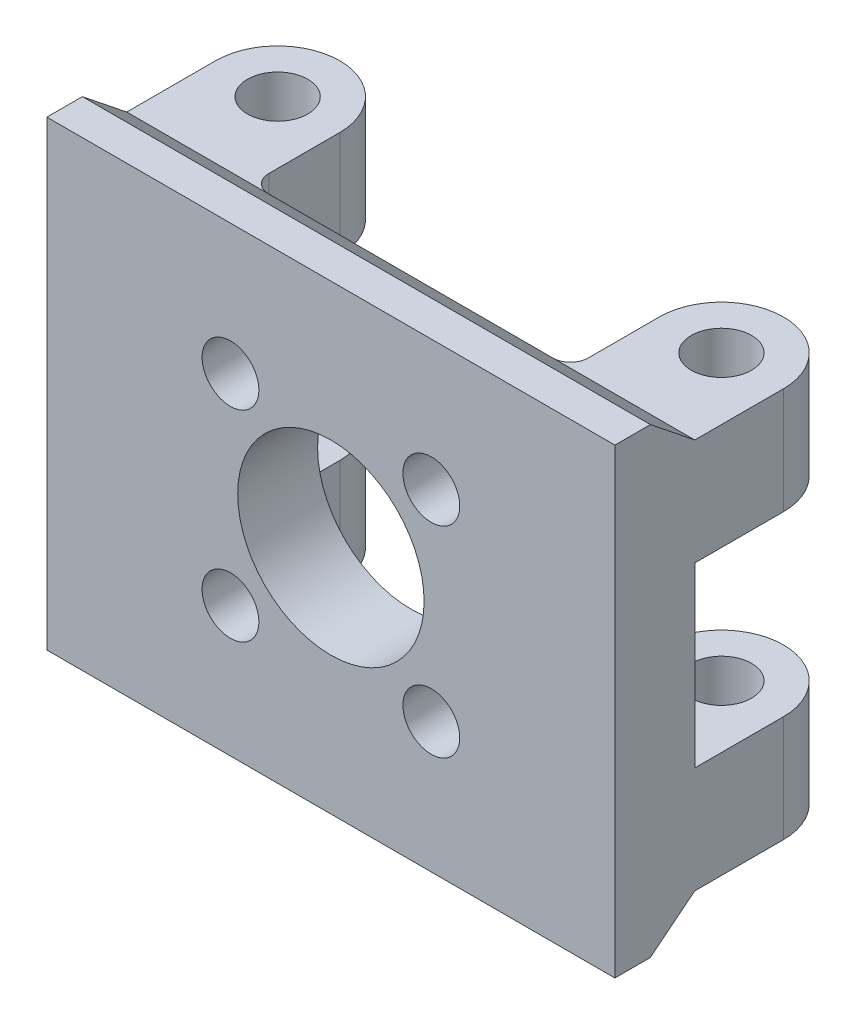
from build123d import *

# Parameters (mm, degrees)
SKETCH_1_W                  = 32
SKETCH_1_H                  = 22
EXTRUDE_1_DEPTH             = 2.5
EXTRUDE_2_DEPTH             = 6
EXTRUDE_3_DEPTH             = 6
EXTRUDE_START               = -6
EXTRUDE_4_DEPTH             = 6
EXTRUDE_5_DEPTH             = 6
HOLE_WIZARD_3_4_3_4_1_D     = 3.4
HOLE_WIZARD_3_4_3_4_1_DEPTH = 6
HOLE_WIZARD_3_4_3_4_2_D     = 3.4
HOLE_WIZARD_3_4_3_4_2_DEPTH = 6
HOLE_WIZARD_3_4_3_4_3_D     = 3.4
HOLE_WIZARD_3_4_3_4_4_D     = 3.4
HOLE_WIZARD_3_4_3_4_4_DEPTH = 22
HOLE_WIZARD_3_2_3_2_1_D     = 3.2
HOLE_WIZARD_10_5_10_5_1_D   = 10.5
EXTRUDE_START_2             = 2
SKETCH_18_R                 = 1.6
SKETCH_18_R_2               = 5.25
EXTRUDE_7_DEPTH             = 2
RIB_1_REACH                 = 43.485
SKETCH_20_WALL_W            = 88.17143617
SKETCH_20_WALL_H            = 32
RIB_2_REACH                 = 43.485
SKETCH_22_WALL_W            = 88.17143617
SKETCH_22_WALL_H            = 32


with BuildPart() as part:
    # 草图1 → 凸台-拉伸1 (new body)
    with BuildSketch(Plane(origin=(0, 0, 0), x_dir=(-1, 0, 0), z_dir=(0, 0, -1))):
        Rectangle(SKETCH_1_W, SKETCH_1_H)
    extrude(amount=-EXTRUDE_1_DEPTH)

    # 草图2 → 凸台-拉伸2 (add)
    with BuildSketch(Plane(origin=(0, 11, 0), x_dir=(1, 0, 0), z_dir=(0, 1, 0))):
        with BuildLine():
            Line((9, 5), (9, 1))
            ThreePointArc((9, 1), (8.707106781, 0.292893219), (8, 0))
            Line((8, 0), (16, 0))
            Line((16, 0), (16, 5))
            ThreePointArc((16, 5), (12.5, 8.5), (9, 5))
        make_face()
    extrude(amount=-EXTRUDE_2_DEPTH)

    # 草图3 → 凸台-拉伸3 (add)
    with BuildSketch(Plane(origin=(0, 11, 0), x_dir=(1, 0, 0), z_dir=(0, 1, 0))):
        with BuildLine():
            Line((-16, 0), (-8, 0))
            ThreePointArc((-8, 0), (-8.707106781, 0.292893219), (-9, 1))
            Line((-9, 1), (-9, 5))
            ThreePointArc((-9, 5), (-12.5, 8.5), (-16, 5))
            Line((-16, 5), (-16, 0))
        make_face()
    extrude(amount=-EXTRUDE_3_DEPTH)

    # 草图4 → 凸台-拉伸4 (add)
    with BuildSketch(Plane.XZ.offset(11).offset(EXTRUDE_START)):
        with BuildLine():
            Line((-8, 0), (-16, 0))
            Line((-16, 0), (-16, -5))
            ThreePointArc((-16, -5), (-12.5, -8.5), (-9, -5))
            Line((-9, -5), (-9, -1))
            ThreePointArc((-9, -1), (-8.707106781, -0.292893219), (-8, 0))
        make_face()
    extrude(amount=EXTRUDE_4_DEPTH)

    # 草图5 → 凸台-拉伸5 (add)
    with BuildSketch(Plane.XZ.offset(11).offset(EXTRUDE_START)):
        with BuildLine():
            Line((16, -5), (16, 0))
            Line((16, 0), (8, 0))
            ThreePointArc((8, 0), (8.707106781, -0.292893219), (9, -1))
            Line((9, -1), (9, -5))
            ThreePointArc((9, -5), (12.5, -8.5), (16, -5))
        make_face()
    extrude(amount=EXTRUDE_5_DEPTH)

    # Ø3.4 (3.4) 直径孔1
    with Locations(Plane(origin=(0, -5, 0), x_dir=(1, 0, 0), z_dir=(0, 1, 0))):
        with Locations((-12.5, 5)):
            Hole(HOLE_WIZARD_3_4_3_4_1_D / 2, depth=HOLE_WIZARD_3_4_3_4_1_DEPTH)

    # Ø3.4 (3.4) 直径孔2
    with Locations(Plane(origin=(0, -11, 0), x_dir=(-1, 0, 0), z_dir=(0, -1, 0))):
        with Locations((-12.5, 5)):
            Hole(HOLE_WIZARD_3_4_3_4_2_D / 2, depth=HOLE_WIZARD_3_4_3_4_2_DEPTH)

    # Ø3.4 (3.4) 直径孔3 (through all)
    with Locations(Plane(origin=(0, 5, 0), x_dir=(-1, 0, 0), z_dir=(0, -1, 0))):
        with Locations((12.5, 5)):
            Hole(HOLE_WIZARD_3_4_3_4_3_D / 2)

    # Ø3.4 (3.4) 直径孔4
    with Locations(Plane(origin=(0, 11, 0), x_dir=(1, 0, 0), z_dir=(0, 1, 0))):
        with Locations((12.5, 5)):
            Hole(HOLE_WIZARD_3_4_3_4_4_D / 2, depth=HOLE_WIZARD_3_4_3_4_4_DEPTH)

    # Ø3.2 (3.2) 直径孔1 (through all)
    with Locations(Plane(origin=(0, 0, 0), x_dir=(-1, 0, 0), z_dir=(0, 0, -1))):
        with Locations((5.656854249, 5.656854249), (-5.656854249, 5.656854249), (-5.656854249, -5.656854249), (5.656854249, -5.656854249)):
            Hole(HOLE_WIZARD_3_2_3_2_1_D / 2)

    # Ø10.5 (10.5) 直径孔1 (through all)
    with Locations(Plane(origin=(0, 0, 0), x_dir=(-1, 0, 0), z_dir=(0, 0, -1))):
        with Locations((0, 0)):
            Hole(HOLE_WIZARD_10_5_10_5_1_D / 2)

    # 草图18 → 凸台-拉伸7 (add)
    with BuildSketch(Plane.XY.offset(2.5).offset(EXTRUDE_START_2)):
        Polygon((-16, 11), (-16, 13), (16, 13), (16, 11), (16, -11), (16, -13), (-16, -13), (-16, -11), align=None)
        with Locations(Location((-5.656854249, 5.656854249, 0), (0, 0, 180))):
            Circle(SKETCH_18_R, mode=Mode.SUBTRACT)
        with Locations(Location((5.656854249, 5.656854249, 0), (0, 0, 180))):
            Circle(SKETCH_18_R, mode=Mode.SUBTRACT)
        with Locations(Location((5.656854249, -5.656854249, 0), (0, 0, 180))):
            Circle(SKETCH_18_R, mode=Mode.SUBTRACT)
        with Locations(Location((-5.656854249, -5.656854249, 0), (0, 0, 180))):
            Circle(SKETCH_18_R, mode=Mode.SUBTRACT)
        with Locations(Location((0, 0, 0), (0, 0, 180))):
            Circle(SKETCH_18_R_2, mode=Mode.SUBTRACT)
    extrude(amount=-EXTRUDE_7_DEPTH)

    # 草图20 wall → 筋1 (add, up to next)
    with BuildSketch(Plane(origin=(-16, -12, 1.25), x_dir=(0, 0.624695047554, -0.780868809443), z_dir=(0, -0.780868809443, -0.624695047554)), mode=Mode.PRIVATE) as rib_1_sk1:
        with Locations((0, 16)):
            Rectangle(SKETCH_20_WALL_W, SKETCH_20_WALL_H)
    rib_1_tool1 = extrude(rib_1_sk1.sketch, amount=-RIB_1_REACH, mode=Mode.PRIVATE) - part.part
    add(rib_1_tool1.solids().sort_by_distance((-16, -12, 1.25))[0])

    # 草图22 wall → 筋2 (add, up to next)
    with BuildSketch(Plane(origin=(16, 12, 1.25), x_dir=(0, -0.624695047554, -0.780868809443), z_dir=(0, 0.780868809443, -0.624695047554)), mode=Mode.PRIVATE) as rib_2_sk1:
        with Locations((0, 16)):
            Rectangle(SKETCH_22_WALL_W, SKETCH_22_WALL_H)
    rib_2_tool1 = extrude(rib_2_sk1.sketch, amount=-RIB_2_REACH, mode=Mode.PRIVATE) - part.part
    add(rib_2_tool1.solids().sort_by_distance((16, 12, 1.25))[0])


solid = part.part
